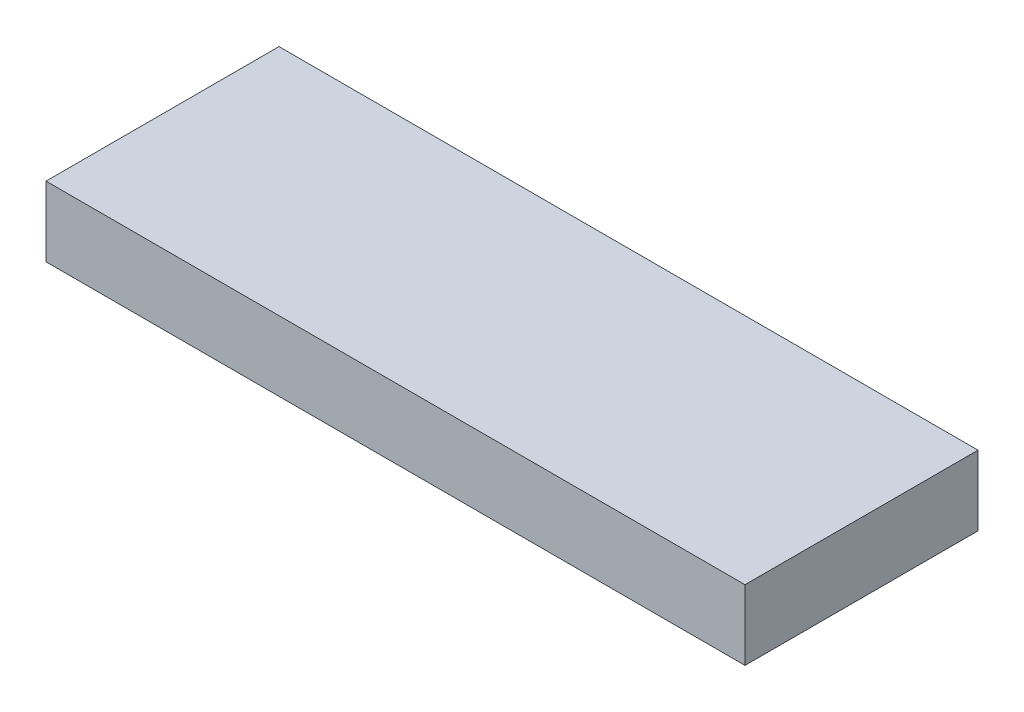
from build123d import *

# Parameters (mm, degrees)
SKETCH1_W           = 150
SKETCH1_H           = 50
BOSS_EXTRUDE1_DEPTH = 7.5


with BuildPart() as part:
    # Sketch1 → Boss-Extrude1 (new, symmetric)
    with BuildSketch(Plane(origin=(0, 0, 0), x_dir=(1, 0, 0), z_dir=(0, 1, 0))):
        Rectangle(SKETCH1_W, SKETCH1_H)
    extrude(amount=BOSS_EXTRUDE1_DEPTH, both=True)


solid = part.part
